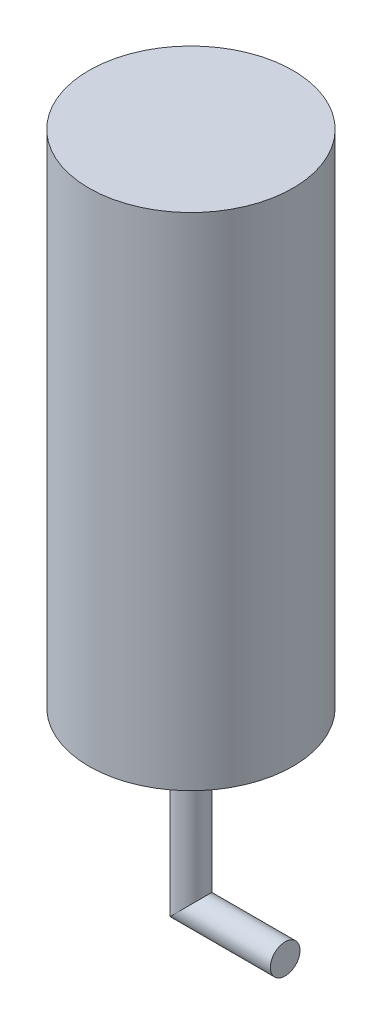
from build123d import *

# Parameters (mm, degrees)
SKETCH1_R           = 2.75
BOSS_EXTRUDE1_DEPTH = 13.5
SKETCH4_R           = 0.4


with BuildPart() as part:
    # Sketch1 → Boss-Extrude1 (new body)
    with BuildSketch(Plane(origin=(0, 0, 0), x_dir=(1, 0, 0), z_dir=(0, 1, 0))):
        with Locations(Location((0, 0, 0), (0, 0, 270))):
            Circle(SKETCH1_R)
    extrude(amount=BOSS_EXTRUDE1_DEPTH)

    # Sweep1: sweep along a curve in space
    with BuildLine() as sweep1_path:
        Line((0, 0, 0), (0, -4.6, 0))
        Line((0, -4.6, 0), (2.54, -4.6, 0))
    # Sketch4 → Sweep1 (sweep)
    with BuildSketch(Plane.XZ):
        Circle(SKETCH4_R)
    sweep(path=sweep1_path.line, transition=Transition.RIGHT)


solid = part.part
